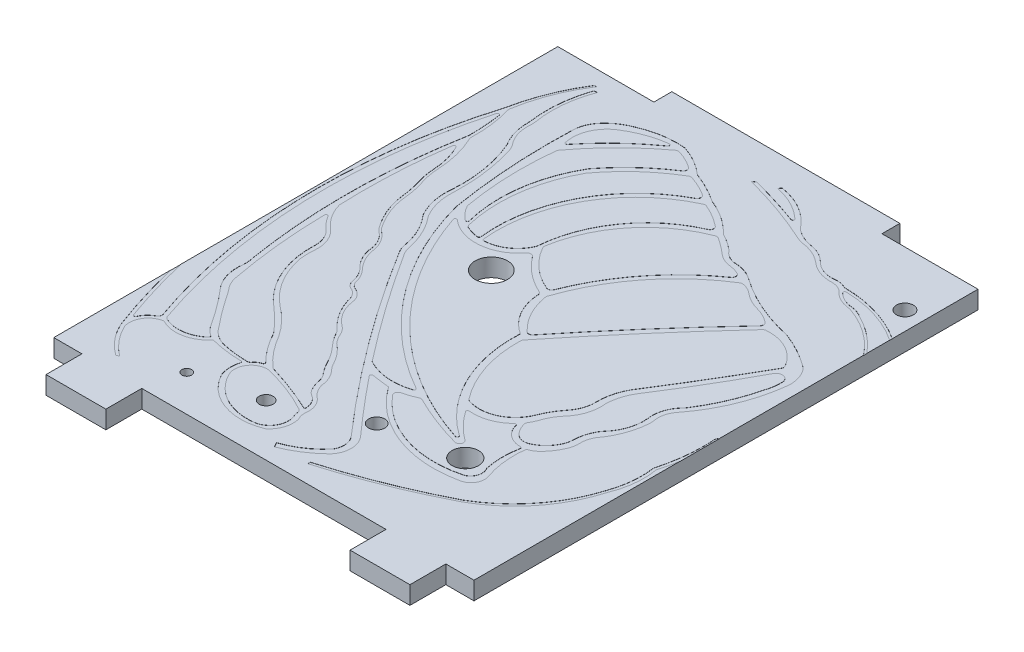
from build123d import *

# Parameters (mm, degrees)
SKETCH_1_W          = 76.2
SKETCH_1_H          = 84.2
EXTRUDE_1_DEPTH     = 3
CUT_EXTRUDE_1_DEPTH = 0.025
SKETCH_7_R          = 1.164516546
SKETCH_7_R_2        = 1.340282989
SKETCH_7_R_3        = 2.198589901
SKETCH_7_R_4        = 0.805257435
SKETCH_7_R_5        = 2.703666194
SKETCH_7_R_6        = 1.417246722
CUT_EXTRUDE_2_DEPTH = 3
SKETCH_8_W          = 3
SKETCH_8_H          = 84.2
CUT_EXTRUDE_3_DEPTH = 3
SKETCH_9_W          = 10
SKETCH_9_H          = 3
EXTRUDE_2_DEPTH     = 3
SKETCH_11_W         = 10
SKETCH_11_H         = 3
EXTRUDE_3_DEPTH     = 3
SKETCH_12_W         = 38.1
SKETCH_12_H         = 3
EXTRUDE_4_DEPTH     = 3


with BuildPart() as part:
    # 스케치1 → 보스-돌출1 (new body)
    with BuildSketch(Plane(origin=(0, 0, 0), x_dir=(1, 0, 0), z_dir=(0, 1, 0))):
        Rectangle(SKETCH_1_W, SKETCH_1_H)
    extrude(amount=EXTRUDE_1_DEPTH)

    # 스케치6 → 컷-돌출1 (cut)
    # profile 1 of 3: a face of its own
    with BuildSketch(Plane(origin=(0, 3, 0), x_dir=(1, 0, 0), z_dir=(0, 1, 0))):
        with BuildLine():
            Line((-1.288081267, -38.698322856), (-0.856988617, -39.489767912))
            ThreePointArc((-0.856988617, -39.489767912), (2.163305382, -37.945287566), (4.820657275, -35.836715468))
            ThreePointArc((4.820657275, -35.836715468), (5.788265872, -33.302315334), (4.820657275, -30.767915199))
            ThreePointArc((4.820657275, -30.767915199), (0.745031105, -26.083187728), (-3.203214001, -21.290614229))
            ThreePointArc((-3.203214001, -21.290614229), (-3.223650991, -21.002467999), (-2.961306749, -20.881548938))
            ThreePointArc((-2.961306749, -20.881548938), (-1.542893411, -21.099143375), (-0.116677598, -21.257737796))
            ThreePointArc((-0.116677598, -21.257737796), (-0.013056044, -21.290423925), (0.067425936, -21.363420227))
            ThreePointArc((0.067425936, -21.363420227), (8.704052471, -28.058439796), (19.601963007, -28.864759124))
            ThreePointArc((19.601963007, -28.864759124), (21.188430939, -27.640214385), (21.201830703, -25.636165792))
            ThreePointArc((21.201830703, -25.636165792), (20.488002771, -22.242901426), (20.527786324, -18.775595462))
            ThreePointArc((20.527786324, -18.775595462), (21.241932407, -18.48973428), (21.875650842, -18.053704246))
            ThreePointArc((21.875650842, -18.053704246), (23.025977567, -16.684760206), (23.865099943, -15.105794407))
            ThreePointArc((23.865099943, -15.105794407), (24.090575495, -14.30220494), (24.135664943, -13.468800959))
            ThreePointArc((24.135664943, -13.468800959), (24.310594023, -12.095298258), (24.963973741, -10.874558812))
            ThreePointArc((24.963973741, -10.874558812), (25.089305308, -10.708492198), (25.205384968, -10.535831738))
            ThreePointArc((25.205384968, -10.535831738), (26.50229419, -7.79128216), (27.090916828, -4.813355145))
            ThreePointArc((27.090916828, -4.813355145), (27.095472208, -4.338079559), (27.040816974, -3.865935047))
            ThreePointArc((27.040816974, -3.865935047), (27.092221239, -2.295993055), (27.780428729, -0.883997762))
            ThreePointArc((27.780428729, -0.883997762), (31.388657151, 5.330504738), (33.168663029, 12.292611656))
            ThreePointArc((33.168663029, 12.292611656), (32.916625007, 14.351234809), (31.865842101, 16.139336521))
            ThreePointArc((31.865842101, 16.139336521), (28.915308809, 18.039426555), (25.73103761, 19.514691201))
            ThreePointArc((25.73103761, 19.514691201), (19.857645951, 21.390922103), (14.483291174, 24.413054249))
            ThreePointArc((14.483291174, 24.413054249), (12.705414464, 25.312718706), (10.732372565, 25.590832708))
            ThreePointArc((10.732372565, 25.590832708), (9.6914929, 26.011740064), (8.829936549, 26.731680433))
            ThreePointArc((8.829936549, 26.731680433), (8.612889668, 26.959974724), (8.37772578, 27.169559021))
            ThreePointArc((8.37772578, 27.169559021), (7.173734821, 28.049645922), (5.879838557, 28.791252046))
            ThreePointArc((5.879838557, 28.791252046), (3.242244687, 31.012210341), (0.185841195, 32.608441799))
            ThreePointArc((0.185841195, 32.608441799), (-2.280638826, 34.062093481), (-4.898819729, 35.220435254))
            ThreePointArc((-4.898819729, 35.220435254), (-7.230563522, 36.906722978), (-9.861045271, 38.073411099))
            ThreePointArc((-9.861045271, 38.073411099), (-13.491092043, 37.951589085), (-16.974666111, 36.923585252))
            ThreePointArc((-16.974666111, 36.923585252), (-18.867949518, 35.960807955), (-20.463117336, 34.558345187))
            ThreePointArc((-20.463117336, 34.558345187), (-21.429019266, 33.026022225), (-21.78160304, 31.249321666))
            ThreePointArc((-21.78160304, 31.249321666), (-21.641358248, 20.853648459), (-20.454106198, 10.525041458))
            ThreePointArc((-20.454106198, 10.525041458), (-11.964867942, -6.647328605), (2.52134795, -19.181562082))
            ThreePointArc((2.52134795, -19.181562082), (2.649236772, -19.427487729), (2.476066021, -19.643929097))
            ThreePointArc((2.476066021, -19.643929097), (-1.347703461, -20.086059035), (-5.033644017, -18.976764595))
            ThreePointArc((-5.033644017, -18.976764595), (-11.688772387, -10.014434431), (-17.903183901, -0.741075539))
            ThreePointArc((-17.903183901, -0.741075539), (-18.223482992, -0.116754034), (-18.423856876, 0.555718387))
            ThreePointArc((-18.423856876, 0.555718387), (-19.536707113, 3.884715004), (-21.439970116, 6.833993572))
            ThreePointArc((-21.439970116, 6.833993572), (-22.526995457, 9.585618383), (-22.732533487, 12.537027761))
            ThreePointArc((-22.732533487, 12.537027761), (-22.985430592, 17.802314588), (-24.103559305, 22.95372124))
            ThreePointArc((-24.103559305, 22.95372124), (-24.379794919, 23.622484651), (-24.777481932, 24.226964307))
            ThreePointArc((-24.777481932, 24.226964307), (-25.810531729, 26.182867418), (-26.039655407, 28.382924509))
            ThreePointArc((-26.039655407, 28.382924509), (-26.028134458, 28.866097457), (-26.077874776, 29.346841392))
            ThreePointArc((-26.077874776, 29.346841392), (-26.240994313, 34.109190155), (-25.152702229, 38.748392034))
            Line((-25.152702229, 38.748392034), (-25.689005486, 38.748392034))
            ThreePointArc((-25.689005486, 38.748392034), (-26.718785004, 33.895450864), (-26.591916637, 28.936077087))
            ThreePointArc((-26.591916637, 28.936077087), (-26.58131282, 28.832308317), (-26.579260438, 28.728019361))
            ThreePointArc((-26.579260438, 28.728019361), (-26.243469831, 26.089419503), (-25.152702229, 23.66347833))
            ThreePointArc((-25.152702229, 23.66347833), (-23.555734758, 18.250945174), (-23.287371161, 12.614119715))
            ThreePointArc((-23.287371161, 12.614119715), (-23.138143206, 9.45175964), (-22.00154516, 6.496944061))
            ThreePointArc((-22.00154516, 6.496944061), (-20.166974678, 3.741337703), (-19.169225652, 0.584834553))
            ThreePointArc((-19.169225652, 0.584834553), (-18.978747188, -0.125042882), (-18.655508808, -0.785137546))
            ThreePointArc((-18.655508808, -0.785137546), (-8.00856429, -16.565085729), (3.91251162, -31.405979953))
            ThreePointArc((3.91251162, -31.405979953), (4.705286508, -33.07630008), (4.340190421, -34.888802825))
            ThreePointArc((4.340190421, -34.888802825), (1.785506433, -37.176882924), (-1.288081267, -38.698322856))
        make_face()
        with BuildLine():
            ThreePointArc((12.943415, -22.388593564), (5.575814291, -13.723587516), (3.320669508, -2.575574598))
            ThreePointArc((3.320669508, -2.575574598), (0.371478954, 0.47891487), (-0.845196429, 4.546756047))
            ThreePointArc((-0.845196429, 4.546756047), (-0.954501811, 4.871196675), (-1.216366434, 5.091733083))
            ThreePointArc((-1.216366434, 5.091733083), (-4.317159393, 7.00063581), (-6.850126995, 9.61652987))
            ThreePointArc((-6.850126995, 9.61652987), (-7.351845844, 9.870018161), (-7.858201956, 9.625924725))
            ThreePointArc((-7.858201956, 9.625924725), (-10.575702517, 7.482139337), (-13.975780775, 6.833993572))
            ThreePointArc((-13.975780775, 6.833993572), (-16.359989657, 7.364481772), (-18.437195702, 8.649427208))
            ThreePointArc((-18.437195702, 8.649427208), (-18.745750096, 8.670134007), (-18.845614546, 8.377453845))
            ThreePointArc((-18.845614546, 8.377453845), (-6.761463605, -10.969447048), (12.718568014, -22.837793446))
            ThreePointArc((12.718568014, -22.837793446), (13.024288829, -22.709948473), (12.943415, -22.388593564))
        make_face(mode=Mode.SUBTRACT)
        with BuildLine():
            ThreePointArc((4.36817574, -3.571187906), (5.318549861, -10.311976236), (8.489982144, -16.335551218))
            ThreePointArc((8.489982144, -16.335551218), (8.623808335, -16.464543628), (8.789252458, -16.549259229))
            ThreePointArc((8.789252458, -16.549259229), (13.305541998, -16.295448261), (16.387759785, -12.984674223))
            ThreePointArc((16.387759785, -12.984674223), (17.210475998, -11.268069676), (18.295422124, -9.703945307))
            ThreePointArc((18.295422124, -9.703945307), (19.232022948, -8.022816701), (19.524317407, -6.120718271))
            ThreePointArc((19.524317407, -6.120718271), (19.91698494, -3.223787663), (21.201830703, -0.59784667))
            ThreePointArc((21.201830703, -0.59784667), (25.736859796, 6.767739024), (30.102010434, 14.235255438))
            ThreePointArc((30.102010434, 14.235255438), (30.18516649, 14.548069615), (30.103334507, 14.861232775))
            ThreePointArc((30.103334507, 14.861232775), (27.247790646, 17.64100305), (23.342786568, 18.436111011))
            ThreePointArc((23.342786568, 18.436111011), (23.117479029, 18.373804332), (22.929983679, 18.234193793))
            ThreePointArc((22.929983679, 18.234193793), (13.528115753, 7.683217883), (4.50693156, -3.195037901))
            ThreePointArc((4.50693156, -3.195037901), (4.40708797, -3.371874594), (4.36817574, -3.571187906))
        make_face(mode=Mode.SUBTRACT)
        with BuildLine():
            ThreePointArc((3.615574526, -1.732160386), (1.31696298, 1.245412213), (0.11752497, 4.810647419))
            ThreePointArc((0.11752497, 4.810647419), (0.111802032, 4.963374438), (0.142736628, 5.113045227))
            ThreePointArc((0.142736628, 5.113045227), (5.658743595, 15.333201712), (14.274546001, 23.120748201))
            ThreePointArc((14.274546001, 23.120748201), (14.478612442, 23.2046013), (14.699052909, 23.213570988))
            ThreePointArc((14.699052909, 23.213570988), (15.660533211, 22.939161973), (16.50439238, 22.402835224))
            ThreePointArc((16.50439238, 22.402835224), (17.92392264, 21.439134523), (19.524317407, 20.820651062))
            ThreePointArc((19.524317407, 20.820651062), (20.886179828, 20.308026881), (22.111180155, 19.522643535))
            ThreePointArc((22.111180155, 19.522643535), (22.347720607, 19.0715516), (22.176710085, 18.591769648))
            ThreePointArc((22.176710085, 18.591769648), (13.16302382, 8.634528037), (4.541705684, -1.664310449))
            ThreePointArc((4.541705684, -1.664310449), (4.093386305, -1.899516606), (3.615574526, -1.732160386))
        make_face(mode=Mode.SUBTRACT)
        with BuildLine():
            ThreePointArc((-1.091092999, 6.239946854), (-4.640008353, 8.47915098), (-7.257406346, 11.759099617))
            ThreePointArc((-7.257406346, 11.759099617), (-7.327800515, 11.958913291), (-7.328548549, 12.170762965))
            ThreePointArc((-7.328548549, 12.170762965), (-3.033700421, 21.708801143), (5.420750369, 27.868521474))
            ThreePointArc((5.420750369, 27.868521474), (5.714274108, 27.90845038), (5.993972307, 27.810882863))
            ThreePointArc((5.993972307, 27.810882863), (7.352988403, 26.863856427), (8.637108164, 25.817519836))
            ThreePointArc((8.637108164, 25.817519836), (9.762307698, 25.096426761), (11.051307468, 24.743540368))
            ThreePointArc((11.051307468, 24.743540368), (11.873301856, 24.58039986), (12.658774484, 24.288299959))
            ThreePointArc((12.658774484, 24.288299959), (13.023039133, 23.769192614), (12.756487884, 23.193769637))
            ThreePointArc((12.756487884, 23.193769637), (5.031092075, 15.85015522), (-0.255014482, 6.594481793))
            ThreePointArc((-0.255014482, 6.594481793), (-0.598447872, 6.24127577), (-1.091092999, 6.239946854))
        make_face(mode=Mode.SUBTRACT)
        with BuildLine():
            ThreePointArc((-7.98643006, 11.42002425), (-10.070913657, 8.866138066), (-13.197847529, 7.822255378))
            ThreePointArc((-13.197847529, 7.822255378), (-13.374449381, 7.88414641), (-13.460730954, 8.050201232))
            ThreePointArc((-13.460730954, 8.050201232), (-10.550631963, 21.879104566), (-0.159439738, 31.456701744))
            ThreePointArc((-0.159439738, 31.456701744), (0.096009496, 31.515805897), (0.353561303, 31.466666512))
            ThreePointArc((0.353561303, 31.466666512), (2.272134822, 30.500274214), (4.036771608, 29.275163839))
            ThreePointArc((4.036771608, 29.275163839), (4.268429809, 28.696454428), (3.893512144, 28.198451568))
            ThreePointArc((3.893512144, 28.198451568), (-4.378416959, 21.460377539), (-7.98643006, 11.42002425))
        make_face(mode=Mode.SUBTRACT)
        with BuildLine():
            ThreePointArc((-14.295127201, 7.871476269), (-15.35778001, 8.079495746), (-16.374835673, 8.451115003))
            ThreePointArc((-16.374835673, 8.451115003), (-16.600880608, 8.624825704), (-16.728148541, 8.879922927))
            ThreePointArc((-16.728148541, 8.879922927), (-17.186903525, 17.740684369), (-14.416557319, 26.16972532))
            ThreePointArc((-14.416557319, 26.16972532), (-10.338099378, 30.672089034), (-5.451861954, 34.281767971))
            ThreePointArc((-5.451861954, 34.281767971), (-5.196607706, 34.367323656), (-4.92884539, 34.339433722))
            ThreePointArc((-4.92884539, 34.339433722), (-3.208547728, 33.652158665), (-1.587718245, 32.755117507))
            ThreePointArc((-1.587718245, 32.755117507), (-1.294944744, 32.193933254), (-1.632579496, 31.658539135))
            ThreePointArc((-1.632579496, 31.658539135), (-11.456033169, 21.81926952), (-14.013701528, 8.152894684))
            ThreePointArc((-14.013701528, 8.152894684), (-14.086427359, 7.944196717), (-14.295127201, 7.871476269))
        make_face(mode=Mode.SUBTRACT)
        with BuildLine():
            ThreePointArc((-17.280012731, 9.497430575), (-17.793981019, 18.510839294), (-14.836024153, 27.040563283))
            ThreePointArc((-14.836024153, 27.040563283), (-11.094535443, 31.119229689), (-6.731223624, 34.524485538))
            ThreePointArc((-6.731223624, 34.524485538), (-6.444142302, 35.049331557), (-6.720621565, 35.579839094))
            ThreePointArc((-6.720621565, 35.579839094), (-8.166693665, 36.416331477), (-9.722090231, 37.025909647))
            ThreePointArc((-9.722090231, 37.025909647), (-10.016050081, 37.044744723), (-10.286881275, 36.928910281))
            ThreePointArc((-10.286881275, 36.928910281), (-15.519086076, 32.413875445), (-20.031152806, 27.179110842))
            ThreePointArc((-20.031152806, 27.179110842), (-20.112307075, 27.032396089), (-20.152233285, 26.869555271))
            ThreePointArc((-20.152233285, 26.869555271), (-20.437997159, 19.238688413), (-19.646926102, 11.64355862))
            ThreePointArc((-19.646926102, 11.64355862), (-19.621355615, 11.545247096), (-19.580435572, 11.452270993))
            ThreePointArc((-19.580435572, 11.452270993), (-18.748877724, 10.24024678), (-17.679584776, 9.231731168))
            ThreePointArc((-17.679584776, 9.231731168), (-17.385324665, 9.222506016), (-17.280012731, 9.497430575))
        make_face(mode=Mode.SUBTRACT)
        with BuildLine():
            ThreePointArc((10.23580954, -18.018118829), (13.230011463, -17.660776076), (15.78548046, -16.059989642))
            ThreePointArc((15.78548046, -16.059989642), (16.03564673, -15.996834792), (16.212006695, -16.185166575))
            ThreePointArc((16.212006695, -16.185166575), (17.449323369, -18.153813902), (19.651228377, -18.900901037))
            ThreePointArc((19.651228377, -18.900901037), (19.84949248, -18.99171038), (19.904270754, -19.202789351))
            ThreePointArc((19.904270754, -19.202789351), (19.651754047, -22.029866662), (19.969816637, -24.850321766))
            ThreePointArc((19.969816637, -24.850321766), (20.214443643, -26.473632592), (19.138558178, -27.713572459))
            ThreePointArc((19.138558178, -27.713572459), (9.504628235, -27.522105201), (1.527662332, -22.116804024))
            ThreePointArc((1.527662332, -22.116804024), (1.417923472, -21.507476149), (1.879066984, -21.094354207))
            ThreePointArc((1.879066984, -21.094354207), (3.011338565, -20.769821678), (4.098582933, -20.316765413))
            ThreePointArc((4.098582933, -20.316765413), (4.379912699, -20.252822188), (4.660498235, -20.319955862))
            ThreePointArc((4.660498235, -20.319955862), (9.018652223, -22.239104084), (13.544296426, -23.720718282))
            ThreePointArc((13.544296426, -23.720718282), (14.283938852, -23.384854354), (14.089032203, -22.596256297))
            ThreePointArc((14.089032203, -22.596256297), (11.876497495, -20.671954716), (10.00223788, -18.416872166))
            ThreePointArc((10.00223788, -18.416872166), (9.990870467, -18.142429128), (10.23580954, -18.018118829))
        make_face(mode=Mode.SUBTRACT)
        with BuildLine():
            ThreePointArc((17.476872701, -13.340654178), (18.08725763, -11.98385161), (18.956597363, -10.776486131))
            ThreePointArc((18.956597363, -10.776486131), (20.320429304, -8.354594818), (20.56806859, -5.58615304))
            ThreePointArc((20.56806859, -5.58615304), (20.925015814, -3.362692326), (21.875650842, -1.321251188))
            ThreePointArc((21.875650842, -1.321251188), (26.223061235, 5.716524284), (30.274444667, 12.928774489))
            ThreePointArc((30.274444667, 12.928774489), (31.355003274, 13.344370767), (32.184777004, 12.537027762))
            ThreePointArc((32.184777004, 12.537027762), (32.145257493, 11.088288565), (31.814078945, 9.677357021))
            ThreePointArc((31.814078945, 9.677357021), (30.278693529, 5.057214248), (27.996173302, 0.756838798))
            ThreePointArc((27.996173302, 0.756838798), (27.797090393, 0.476026541), (27.573475284, 0.214328602))
            ThreePointArc((27.573475284, 0.214328602), (26.384798224, -1.84148381), (26.223061235, -4.210694432))
            ThreePointArc((26.223061235, -4.210694432), (25.893173399, -7.125385382), (24.424861682, -9.664737664))
            ThreePointArc((24.424861682, -9.664737664), (24.150039275, -10.01015364), (23.917012103, -10.385037474))
            ThreePointArc((23.917012103, -10.385037474), (23.312284364, -11.903993841), (23.083697385, -13.522842839))
            ThreePointArc((23.083697385, -13.522842839), (22.971984112, -14.362170674), (22.677653609, -15.156098017))
            ThreePointArc((22.677653609, -15.156098017), (21.547858268, -16.675830878), (19.969816637, -17.72264036))
            ThreePointArc((19.969816637, -17.72264036), (18.909103721, -17.859450913), (17.941833795, -17.403141906))
            ThreePointArc((17.941833795, -17.403141906), (17.15065003, -16.433151491), (16.707690356, -15.262408186))
            ThreePointArc((16.707690356, -15.262408186), (16.705012763, -15.023507591), (16.790805005, -14.800526974))
            ThreePointArc((16.790805005, -14.800526974), (17.17667052, -14.090719332), (17.476872701, -13.340654178))
        make_face(mode=Mode.SUBTRACT)
        with BuildLine():
            ThreePointArc((-11.551627946, 36.893593338), (-16.130592415, 33.132745904), (-20.144777887, 28.774167692))
            ThreePointArc((-20.144777887, 28.774167692), (-20.399631471, 28.685230489), (-20.590644995, 28.875950203))
            ThreePointArc((-20.590644995, 28.875950203), (-20.310903736, 32.355152444), (-18.082014139, 35.04125642))
            ThreePointArc((-18.082014139, 35.04125642), (-15.035746648, 36.552363633), (-11.730772152, 37.352572488))
            ThreePointArc((-11.730772152, 37.352572488), (-11.462216112, 37.192942154), (-11.551627946, 36.893593338))
        make_face(mode=Mode.SUBTRACT)
    # profile 2 of 3: a face of its own
    with BuildSketch(Plane(origin=(0, 3, 0), x_dir=(1, 0, 0), z_dir=(0, 1, 0))):
        with BuildLine():
            Line((3.767986257, 39.946006791), (4.128269492, 40.379673924))
            ThreePointArc((4.128269492, 40.379673924), (8.279952992, 38.888588792), (11.563682416, 35.942925568))
            ThreePointArc((11.563682416, 35.942925568), (13.252849321, 34.935343836), (15.152918239, 34.427166815))
            ThreePointArc((15.152918239, 34.427166815), (16.657714127, 33.87771421), (17.941833795, 32.919932655))
            ThreePointArc((17.941833795, 32.919932655), (19.799250548, 31.75093957), (21.986657417, 31.572633609))
            ThreePointArc((21.986657417, 31.572633609), (22.858945173, 31.504638407), (23.674000317, 31.186527753))
            ThreePointArc((23.674000317, 31.186527753), (32.504098944, 29.223230598), (39.704849342, 23.748345103))
            Line((39.704849342, 23.748345103), (39.550205146, 23.237412878))
            ThreePointArc((39.550205146, 23.237412878), (32.866283832, 28.641244079), (24.518720487, 30.689263113))
            ThreePointArc((24.518720487, 30.689263113), (24.27924736, 30.533744697), (24.335691597, 30.253838633))
            ThreePointArc((24.335691597, 30.253838633), (25.429452733, 29.458890422), (26.706124915, 29.01350944))
            ThreePointArc((26.706124915, 29.01350944), (27.996819758, 28.79890021), (29.182944909, 28.24658017))
            ThreePointArc((29.182944909, 28.24658017), (35.510787351, 23.013992874), (38.901771187, 15.535838797))
            ThreePointArc((38.901771187, 15.535838797), (38.40077538, 6.741740255), (35.355861094, -1.523588714))
            ThreePointArc((35.355861094, -1.523588714), (35.300074491, -6.246380616), (34.357820771, -10.874558812))
            ThreePointArc((34.357820771, -10.874558812), (34.481522468, -14.621784028), (33.554550212, -18.254650853))
            ThreePointArc((33.554550212, -18.254650853), (29.473331353, -26.12752388), (22.677653609, -31.824649564))
            ThreePointArc((22.677653609, -31.824649564), (13.700842094, -35.910753173), (4.376165166, -39.124751909))
            Line((4.376165166, -39.124751909), (4.340190421, -38.698322856))
            ThreePointArc((4.340190421, -38.698322856), (13.65472608, -35.483423568), (22.625267064, -31.405979953))
            ThreePointArc((22.625267064, -31.405979953), (29.159943945, -25.727131769), (33.168663029, -18.053704246))
            ThreePointArc((33.168663029, -18.053704246), (33.961834168, -14.507484642), (33.880324352, -10.874558812))
            ThreePointArc((33.880324352, -10.874558812), (34.764770739, -6.240598395), (34.839965425, -1.523588714))
            ThreePointArc((34.839965425, -1.523588714), (37.946019587, 6.729867702), (38.417175971, 15.535838797))
            ThreePointArc((38.417175971, 15.535838797), (34.621124584, 23.563158767), (27.263902974, 28.534995673))
            ThreePointArc((27.263902974, 28.534995673), (25.642744664, 28.903165514), (24.212930135, 29.751300947))
            ThreePointArc((24.212930135, 29.751300947), (23.232986978, 30.582176354), (21.986657417, 30.8941141))
            ThreePointArc((21.986657417, 30.8941141), (19.758486699, 31.195558699), (17.80698796, 32.312369455))
            ThreePointArc((17.80698796, 32.312369455), (15.860260205, 33.544313575), (13.630722652, 34.124483869))
            ThreePointArc((13.630722652, 34.124483869), (13.170007367, 34.26184853), (12.718568014, 34.427166815))
            ThreePointArc((12.718568014, 34.427166815), (6.72469729, 36.866935252), (0.532841618, 38.748392033))
            Line((0.532841618, 38.748392033), (1.115324635, 39.135892384))
            ThreePointArc((1.115324635, 39.135892384), (5.273365098, 37.951762306), (9.371201344, 36.573646694))
            ThreePointArc((9.371201344, 36.573646694), (9.675034086, 36.680803864), (9.629367266, 36.999726325))
            ThreePointArc((9.629367266, 36.999726325), (6.903136122, 38.879621525), (3.767986257, 39.946006791))
        make_face()
    # profile 3 of 3: a face of its own
    with BuildSketch(Plane(origin=(0, 3, 0), x_dir=(1, 0, 0), z_dir=(0, 1, 0))):
        with BuildLine():
            Line((-27.340688923, -39.489767912), (-26.918462969, -39.277252622))
            ThreePointArc((-26.918462969, -39.277252622), (-29.153792944, -37.160765802), (-30.818383268, -34.571295661))
            ThreePointArc((-30.818383268, -34.571295661), (-30.488035292, -31.955983279), (-28.294477719, -30.494034644))
            ThreePointArc((-28.294477719, -30.494034644), (-24.697043873, -31.055585607), (-21.540463126, -29.240959544))
            ThreePointArc((-21.540463126, -29.240959544), (-21.42450857, -29.164480316), (-21.285662801, -29.160432625))
            ThreePointArc((-21.285662801, -29.160432625), (-18.722318173, -29.649635934), (-16.119118831, -29.832416535))
            ThreePointArc((-16.119118831, -29.832416535), (-15.918417267, -29.934348489), (-15.87751416, -30.155703807))
            ThreePointArc((-15.87751416, -30.155703807), (-16.073736206, -31.755488516), (-15.774788408, -33.339295455))
            ThreePointArc((-15.774788408, -33.339295455), (-10.830360756, -37.74348281), (-4.210296401, -37.605718534))
            ThreePointArc((-4.210296401, -37.605718534), (-2.908030631, -35.6712157), (-2.889447846, -33.339295455))
            ThreePointArc((-2.889447846, -33.339295455), (-3.161983446, -32.606438518), (-3.174671099, -31.824649564))
            ThreePointArc((-3.174671099, -31.824649564), (-3.45835208, -30.024437358), (-4.615192534, -28.616261569))
            ThreePointArc((-4.615192534, -28.616261569), (-5.35216002, -27.719044445), (-5.81744829, -26.655265112))
            ThreePointArc((-5.81744829, -26.655265112), (-6.258347953, -24.955687373), (-7.265938594, -23.517731149))
            ThreePointArc((-7.265938594, -23.517731149), (-7.682831218, -22.975508667), (-8.024541131, -22.383023211))
            ThreePointArc((-8.024541131, -22.383023211), (-9.142907214, -20.727754865), (-10.586261783, -19.346674281))
            ThreePointArc((-10.586261783, -19.346674281), (-11.142190963, -18.612605091), (-11.582193828, -17.803709357))
            ThreePointArc((-11.582193828, -17.803709357), (-12.054045352, -16.973569065), (-12.736147559, -16.305352525))
            ThreePointArc((-12.736147559, -16.305352525), (-14.477370096, -14.376677499), (-15.326508493, -11.920948023))
            ThreePointArc((-15.326508493, -11.920948023), (-15.853684751, -10.672173211), (-16.943514793, -9.866180769))
            ThreePointArc((-16.943514793, -9.866180769), (-17.658881423, -9.326467709), (-17.983577554, -8.49123599))
            ThreePointArc((-17.983577554, -8.49123599), (-18.490894432, -7.364235189), (-19.249619305, -6.388613445))
            ThreePointArc((-19.249619305, -6.388613445), (-20.324514715, -4.893143646), (-20.979513761, -3.171863217))
            ThreePointArc((-20.979513761, -3.171863217), (-21.623356505, -1.045935819), (-23.072157235, 0.637832938))
            ThreePointArc((-23.072157235, 0.637832938), (-23.379895806, 0.915286431), (-23.638429925, 1.239082011))
            ThreePointArc((-23.638429925, 1.239082011), (-24.259876077, 2.23211891), (-24.814554543, 3.263937404))
            ThreePointArc((-24.814554543, 3.263937404), (-25.667495349, 5.48653715), (-26.090653611, 7.829269472))
            ThreePointArc((-26.090653611, 7.829269472), (-26.326423735, 9.439287852), (-26.755028708, 11.00901538))
            ThreePointArc((-26.755028708, 11.00901538), (-27.206303513, 12.724573324), (-27.414134399, 14.486275437))
            ThreePointArc((-27.414134399, 14.486275437), (-27.921518655, 17.974299985), (-29.091285151, 21.299266207))
            ThreePointArc((-29.091285151, 21.299266207), (-29.183974546, 21.580512069), (-29.209013355, 21.875577515))
            ThreePointArc((-29.209013355, 21.875577515), (-29.366470984, 25.254410443), (-30.052031609, 28.566707455))
            ThreePointArc((-30.052031609, 28.566707455), (-30.100292615, 28.846346287), (-30.085256655, 29.129720458))
            ThreePointArc((-30.085256655, 29.129720458), (-28.600563276, 34.546122085), (-26.043624682, 39.546500676))
            Line((-26.043624682, 39.546500676), (-26.433227843, 39.546500676))
            ThreePointArc((-26.433227843, 39.546500676), (-29.050281997, 34.387411738), (-30.679506687, 28.836664219))
            ThreePointArc((-30.679506687, 28.836664219), (-34.667198889, -0.491989388), (-29.338891824, -29.606946975))
            ThreePointArc((-29.338891824, -29.606946975), (-29.346665702, -30.050238536), (-29.642580007, -30.380393903))
            ThreePointArc((-29.642580007, -30.380393903), (-30.607852729, -31.118915793), (-31.272258841, -32.136624261))
            ThreePointArc((-31.272258841, -32.136624261), (-31.513052594, -32.289561855), (-31.744116675, -32.122286843))
            ThreePointArc((-31.744116675, -32.122286843), (-34.141582129, -24.565849366), (-35.916295084, -16.839402454))
            ThreePointArc((-35.916295084, -16.839402454), (-38.025584981, -8.104638335), (-40.102699355, 0.637832938))
            Line((-40.102699355, 0.637832938), (-40.51464583, 0.396888552))
            ThreePointArc((-40.51464583, 0.396888552), (-38.336418197, -8.496894822), (-36.209725647, -17.403141906))
            ThreePointArc((-36.209725647, -17.403141906), (-34.199718307, -26.093668581), (-31.425691905, -34.571295661))
            ThreePointArc((-31.425691905, -34.571295661), (-29.711551097, -37.303249472), (-27.340688923, -39.489767912))
        make_face()
        with BuildLine():
            ThreePointArc((-12.571599975, -28.812394943), (-14.989533648, -30.054229204), (-15.150749983, -32.767633868))
            ThreePointArc((-15.150749983, -32.767633868), (-11.35902576, -36.664604316), (-6.003854867, -37.605718534))
            ThreePointArc((-6.003854867, -37.605718534), (-3.815054075, -36.03250714), (-3.703457406, -33.339295455))
            ThreePointArc((-3.703457406, -33.339295455), (-3.858174564, -32.945696443), (-3.916126191, -32.526770209))
            ThreePointArc((-3.916126191, -32.526770209), (-4.008451582, -32.208859983), (-4.248237394, -31.980619641))
            ThreePointArc((-4.248237394, -31.980619641), (-8.304168993, -30.118688289), (-12.571599975, -28.812394943))
        make_face(mode=Mode.SUBTRACT)
        with BuildLine():
            ThreePointArc((-14.99015864, -29.134098168), (-14.517799459, -28.680467449), (-13.920948647, -28.410887899))
            ThreePointArc((-13.920948647, -28.410887899), (-13.739805099, -28.232356357), (-13.804221488, -27.986313627))
            ThreePointArc((-13.804221488, -27.986313627), (-15.767052771, -25.680950174), (-17.362787605, -23.107812473))
            ThreePointArc((-17.362787605, -23.107812473), (-19.143865906, -21.153327137), (-21.074735737, -19.346674281))
            ThreePointArc((-21.074735737, -19.346674281), (-25.32188968, -13.834184518), (-26.639748942, -7.001241743))
            ThreePointArc((-26.639748942, -7.001241743), (-27.062869829, -4.955640993), (-28.403432957, -3.353640926))
            ThreePointArc((-28.403432957, -3.353640926), (-29.130334589, -2.524292905), (-29.766028797, -1.62312866))
            ThreePointArc((-29.766028797, -1.62312866), (-30.053102915, -1.514862292), (-30.234978083, -1.761954538))
            ThreePointArc((-30.234978083, -1.761954538), (-29.757792927, -10.044827756), (-28.560922372, -18.254650853))
            ThreePointArc((-28.560922372, -18.254650853), (-28.193962376, -19.384163698), (-27.557455301, -20.386818998))
            ThreePointArc((-27.557455301, -20.386818998), (-27.131947276, -20.930347622), (-26.736598947, -21.49619225))
            ThreePointArc((-26.736598947, -21.49619225), (-24.89844579, -24.127464662), (-22.920409792, -26.655265113))
            ThreePointArc((-22.920409792, -26.655265113), (-21.643508734, -28.033682463), (-19.958331507, -28.864759124))
            ThreePointArc((-19.958331507, -28.864759124), (-17.747027368, -29.250183149), (-15.50689061, -29.392327382))
            ThreePointArc((-15.50689061, -29.392327382), (-15.217460866, -29.325373198), (-14.99015864, -29.134098168))
        make_face(mode=Mode.SUBTRACT)
        with BuildLine():
            ThreePointArc((-28.318292238, -29.956120413), (-25.154126144, -30.439196519), (-22.248276299, -29.097054101))
            ThreePointArc((-22.248276299, -29.097054101), (-22.163296357, -28.889082521), (-22.276542631, -28.69504889))
            ThreePointArc((-22.276542631, -28.69504889), (-23.186038652, -27.92830701), (-23.894768627, -26.97291288))
            ThreePointArc((-23.894768627, -26.97291288), (-26.119555939, -23.784252189), (-28.560921981, -20.758204034))
            ThreePointArc((-28.560921981, -20.758204034), (-29.702360103, -18.347887009), (-29.835143081, -15.684265821))
            ThreePointArc((-29.835143081, -15.684265821), (-29.868276259, -14.674435835), (-30.052022263, -13.68091089))
            ThreePointArc((-30.052022263, -13.68091089), (-31.370186807, 4.039694822), (-29.697253158, 21.730334086))
            ThreePointArc((-29.697253158, 21.730334086), (-29.682186422, 21.841924399), (-29.677063187, 21.954410652))
            ThreePointArc((-29.677063187, 21.954410652), (-29.770985678, 24.605801064), (-30.058442064, 27.243235683))
            ThreePointArc((-30.058442064, 27.243235683), (-30.294246905, 27.460024782), (-30.554740838, 27.273626426))
            ThreePointArc((-30.554740838, 27.273626426), (-33.912072133, -1.303504524), (-28.64554559, -29.591095176))
            ThreePointArc((-28.64554559, -29.591095176), (-28.518565726, -29.806462487), (-28.318292238, -29.956120413))
        make_face(mode=Mode.SUBTRACT)
        with BuildLine():
            ThreePointArc((-12.50517702, -28.108889998), (-14.691026865, -25.76167164), (-16.492250084, -23.107812473))
            ThreePointArc((-16.492250084, -23.107812473), (-18.453279779, -20.684970723), (-20.781460761, -18.612442575))
            ThreePointArc((-20.781460761, -18.612442575), (-24.110824409, -14.826366513), (-25.932941083, -10.125417133))
            ThreePointArc((-25.932941083, -10.125417133), (-26.006777082, -8.832714301), (-25.963231029, -7.538636982))
            ThreePointArc((-25.963231029, -7.538636982), (-26.347241788, -5.137426655), (-27.787160846, -3.177858232))
            ThreePointArc((-27.787160846, -3.177858232), (-29.425579249, -1.309904018), (-30.433138634, 0.961327342))
            ThreePointArc((-30.433138634, 0.961327342), (-30.399865026, 10.000705631), (-29.541341622, 18.99928355))
            ThreePointArc((-29.541341622, 18.99928355), (-29.330410409, 19.214370629), (-29.062432201, 19.076740296))
            ThreePointArc((-29.062432201, 19.076740296), (-28.147924798, 16.645874354), (-27.743325525, 14.08038562))
            ThreePointArc((-27.743325525, 14.08038562), (-27.569085045, 12.567872614), (-27.215097859, 11.087079443))
            ThreePointArc((-27.215097859, 11.087079443), (-26.771618683, 9.346295751), (-26.487011705, 7.572598903))
            ThreePointArc((-26.487011705, 7.572598903), (-26.111177394, 5.635908592), (-25.439940597, 3.780790819))
            ThreePointArc((-25.439940597, 3.780790819), (-24.689787211, 2.320924926), (-23.798343663, 0.942785988))
            ThreePointArc((-23.798343663, 0.942785988), (-23.551726413, 0.649624886), (-23.263823921, 0.396888552))
            ThreePointArc((-23.263823921, 0.396888552), (-21.938992499, -1.179818875), (-21.439970116, -3.177858232))
            ThreePointArc((-21.439970116, -3.177858232), (-20.712136272, -5.055835503), (-19.442801805, -6.619590838))
            ThreePointArc((-19.442801805, -6.619590838), (-18.708561181, -7.726326098), (-18.322183668, -8.997028521))
            ThreePointArc((-18.322183668, -8.997028521), (-17.989482313, -9.702024384), (-17.362787605, -10.165665518))
            ThreePointArc((-17.362787605, -10.165665518), (-16.357063328, -10.992322714), (-15.87980134, -12.203547068))
            ThreePointArc((-15.87980134, -12.203547068), (-14.642329521, -14.871303986), (-12.736147559, -17.110664118))
            ThreePointArc((-12.736147559, -17.110664118), (-12.433441404, -17.433369839), (-12.191328538, -17.803709357))
            ThreePointArc((-12.191328538, -17.803709357), (-11.459864976, -18.984547099), (-10.586261783, -20.064470325))
            ThreePointArc((-10.586261783, -20.064470325), (-9.505778185, -21.414847662), (-8.618775612, -22.899499202))
            ThreePointArc((-8.618775612, -22.899499202), (-7.993731805, -23.972902436), (-7.250833855, -24.968380665))
            ThreePointArc((-7.250833855, -24.968380665), (-6.891553886, -25.534276733), (-6.692820779, -26.174452966))
            ThreePointArc((-6.692820779, -26.174452966), (-6.447285086, -27.122093623), (-6.045211438, -28.014644672))
            ThreePointArc((-6.045211438, -28.014644672), (-5.657578993, -28.538775514), (-5.1493058, -28.946979401))
            ThreePointArc((-5.1493058, -28.946979401), (-4.162683324, -30.016605058), (-3.888596365, -31.445730418))
            ThreePointArc((-3.888596365, -31.445730418), (-8.011836277, -29.689673438), (-12.256056408, -28.25042399))
            ThreePointArc((-12.256056408, -28.25042399), (-12.388703663, -28.193891211), (-12.50517702, -28.108889998))
        make_face(mode=Mode.SUBTRACT)
    extrude(amount=-CUT_EXTRUDE_1_DEPTH, mode=Mode.SUBTRACT)

    # 스케치7 → 컷-돌출2 (cut)
    with BuildSketch(Plane(origin=(0, 3, 0), x_dir=(1, 0, 0), z_dir=(0, 1, 0))):
        with Locations(Location((-8.302981984, -33.422792019, 0), (0, 0, 270))):
            Circle(SKETCH_7_R)
        with Locations(Location((4.30161416, -27.561654812, 0), (0, 0, 270))):
            Circle(SKETCH_7_R_2)
        with Locations(Location((16.707791933, -25.159424096, 0), (0, 0, 270))):
            Circle(SKETCH_7_R_3)
        with Locations(Location((-18.962679175, -36.022099547, 0), (0, 0, 270))):
            Circle(SKETCH_7_R_4)
        with Locations(Location((-8.302981984, 4.201111316, 0), (0, 0, 270))):
            Circle(SKETCH_7_R_5)
        with Locations(Location((32.005102863, 32.99216771, 0), (0, 0, 270))):
            Circle(SKETCH_7_R_6)
    extrude(amount=-CUT_EXTRUDE_2_DEPTH, mode=Mode.SUBTRACT)

    # 스케치8 → 컷-돌출3 (cut)
    with BuildSketch(Plane(origin=(0, 3, 0), x_dir=(1, 0, 0), z_dir=(0, 1, 0))):
        with Locations((-36.6, 0)):
            Rectangle(SKETCH_8_W, SKETCH_8_H)
        with Locations((36.6, 0)):
            Rectangle(SKETCH_8_W, SKETCH_8_H)
    extrude(amount=-CUT_EXTRUDE_3_DEPTH, mode=Mode.SUBTRACT)

    # 스케치9 → 보스-돌출2 (add)
    with BuildSketch(Plane(origin=(0, 3, 0), x_dir=(1, 0, 0), z_dir=(0, 1, 0))):
        with Locations((25.4, -43.6)):
            Rectangle(SKETCH_9_W, SKETCH_9_H)
        with Locations((-25.4, -43.6)):
            Rectangle(SKETCH_9_W, SKETCH_9_H)
    extrude(amount=-EXTRUDE_2_DEPTH)

    # 스케치11 → 보스-돌출3 (add)
    with BuildSketch(Plane.XY.offset(45.1)):
        with Locations((25.4, 1.5)):
            Rectangle(SKETCH_11_W, SKETCH_11_H)
        with Locations((-25.4, 1.5)):
            Rectangle(SKETCH_11_W, SKETCH_11_H)
    extrude(amount=EXTRUDE_3_DEPTH)

    # 스케치12 → 보스-돌출4 (add)
    with BuildSketch(Plane(origin=(0, 3, 0), x_dir=(1, 0, 0), z_dir=(0, 1, 0))):
        with Locations((0, 43.6)):
            Rectangle(SKETCH_12_W, SKETCH_12_H)
    extrude(amount=-EXTRUDE_4_DEPTH)


solid = part.part
